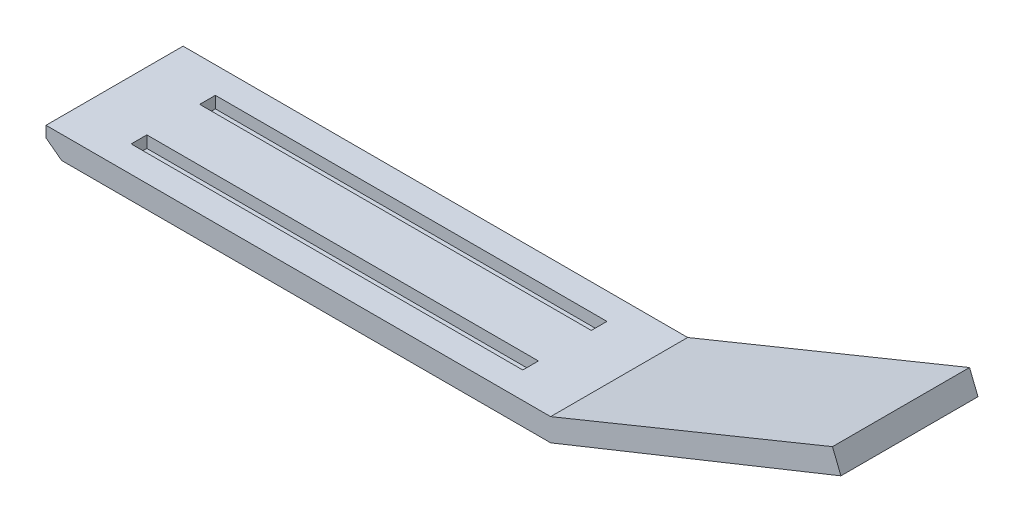
from build123d import *

# Parameters (mm, degrees)
SALIENTE_EXTRUIR2_DEPTH = 350
CORTAR_EXTRUIR1_DEPTH   = 350
CROQUIS4_W              = 1000
CROQUIS4_H              = 40
CORTAR_EXTRUIR2_DEPTH   = 30


with BuildPart() as part:
    # Croquis2 → Saliente-Extruir2 (new body)
    with BuildSketch(Plane.XY):
        Polygon((0, 0), (741.33697933, 297.624853905), (719.728110413, 351.449167966), (0, 58), (-1288.66302067, 58), (-1288.66302067, 0), align=None)
    extrude(amount=SALIENTE_EXTRUIR2_DEPTH)

    # Croquis3 → Cortar-Extruir1 (cut)
    with BuildSketch(Plane.XY.offset(350)):
        Polygon((-1288.66302067, 30), (-1288.66302067, 0), (-1248.66302067, 0), align=None)
    extrude(amount=-CORTAR_EXTRUIR1_DEPTH, mode=Mode.SUBTRACT)

    # Croquis4 → Cortar-Extruir2 (cut)
    with BuildSketch(Plane(origin=(0, 58, 0), x_dir=(1, 0, 0), z_dir=(0, 1, 0))):
        with Locations((-638.66302067, -87.5)):
            Rectangle(CROQUIS4_W, CROQUIS4_H)
        with Locations((-638.66302067, -262.5)):
            Rectangle(CROQUIS4_W, CROQUIS4_H)
    extrude(amount=-CORTAR_EXTRUIR2_DEPTH, mode=Mode.SUBTRACT)


solid = part.part
